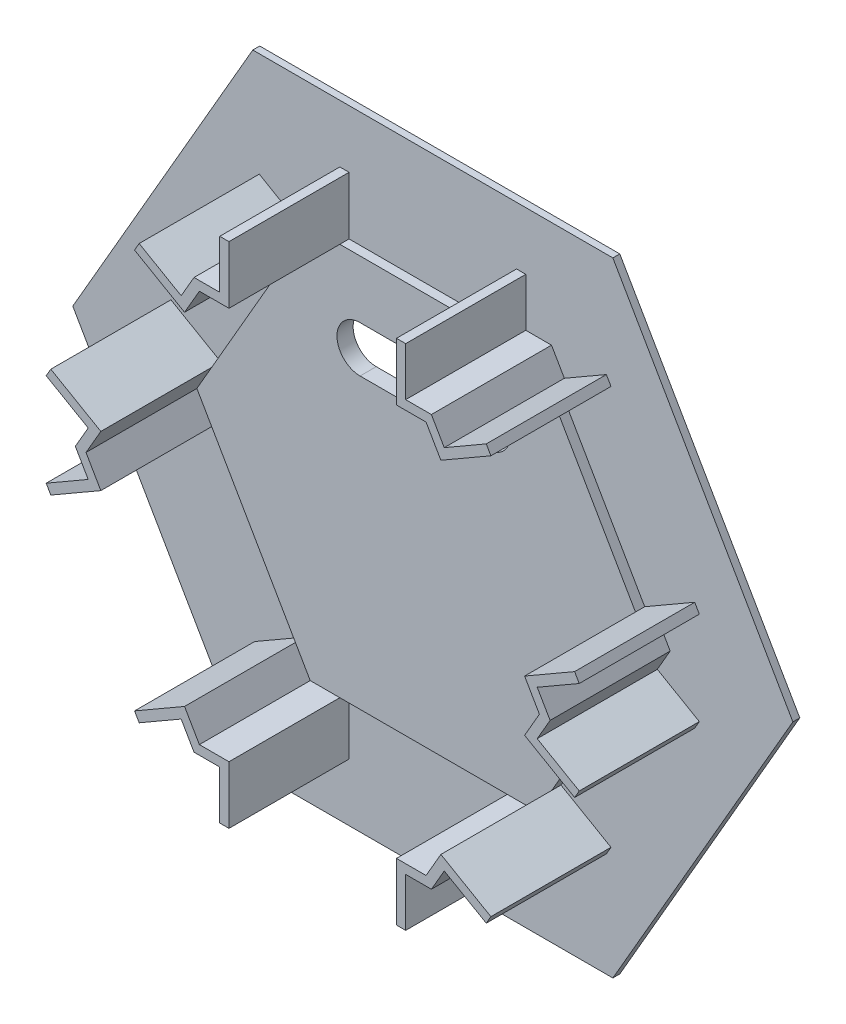
from build123d import *

# Parameters (mm, degrees)
BOSS_EXTRUDE1_DEPTH     = 1.4
SKETCH2_W               = 14.5
SKETCH2_H               = 10
BOSS_EXTRUDE2_DEPTH     = 0.6
BOSS_EXTRUDE3_DEPTH     = 11
BOSS_EXTRUDE4_DEPTH     = 0.6
CUT_EXTRUDE1_DEPTH      = 43.345719973
CUT_EXTRUDE1_DEPTH_BACK = 43.345719973


with BuildPart() as part:
    # Sketch1 → Boss-Extrude1 (new body)
    with BuildSketch(Plane.XY):
        Polygon((19.629909152, 0), (9.814954576, 17), (-9.814954576, 17), (-19.629909152, 0), (-9.814954576, -17), (9.814954576, -17), align=None)
    extrude(amount=BOSS_EXTRUDE1_DEPTH)

    # Sketch2 → Boss-Extrude2 (add)
    with BuildSketch(Plane.XY):
        with Locations((0, 22)):
            Rectangle(SKETCH2_W, SKETCH2_H)
        Polygon((19.757685902, 19.778684177), (27.007685902, 7.221315823), (18.347431864, 2.221315823), (11.097431864, 14.778684177), align=None)
        Polygon((27.007685902, -7.221315823), (19.757685902, -19.778684177), (11.097431864, -14.778684177), (18.347431864, -2.221315823), align=None)
        with Locations((0, -22)):
            Rectangle(SKETCH2_W, SKETCH2_H)
        Polygon((-19.757685902, -19.778684177), (-27.007685902, -7.221315823), (-18.347431864, -2.221315823), (-11.097431864, -14.778684177), align=None)
        Polygon((-27.007685902, 7.221315823), (-19.757685902, 19.778684177), (-11.097431864, 14.778684177), (-18.347431864, 2.221315823), align=None)
    extrude(amount=BOSS_EXTRUDE2_DEPTH)

    # Sketch3 → Boss-Extrude3 (add)
    with BuildSketch(Plane.XY):
        Polygon((-7.25, 22), (-8.05, 22), (-8.05, 17.8), (-10.276834792, 17.8), (-11.390252187, 15.8715045), (-15.027558883, 17.9715045), (-15.427558883, 17.278684177), (-11.097431864, 14.778684177), (-9.814954576, 17), (-7.25, 17), align=None)
        Polygon((15.427558883, 17.278684177), (15.027558883, 17.9715045), (11.390252187, 15.8715045), (10.276834792, 17.8), (8.05, 17.8), (8.05, 22), (7.25, 22), (7.25, 17), (9.814954576, 17), (11.097431864, 14.778684177), align=None)
        Polygon((22.677558883, -4.721315823), (23.077558883, -4.0284955), (19.440252187, -1.9284955), (20.553669583, 0), (19.440252187, 1.9284955), (23.077558883, 4.0284955), (22.677558883, 4.721315823), (18.347431864, 2.221315823), (19.629909152, 0), (18.347431864, -2.221315823), align=None)
        Polygon((7.25, -22), (8.05, -22), (8.05, -17.8), (10.276834792, -17.8), (11.390252187, -15.8715045), (15.027558883, -17.9715045), (15.427558883, -17.278684177), (11.097431864, -14.778684177), (9.814954576, -17), (7.25, -17), align=None)
        Polygon((-15.427558883, -17.278684177), (-15.027558883, -17.9715045), (-11.390252187, -15.8715045), (-10.276834792, -17.8), (-8.05, -17.8), (-8.05, -22), (-7.25, -22), (-7.25, -17), (-9.814954576, -17), (-11.097431864, -14.778684177), align=None)
        Polygon((-22.677558883, 4.721315823), (-23.077558883, 4.0284955), (-19.440252187, 1.9284955), (-20.553669583, 0), (-19.440252187, -1.9284955), (-23.077558883, -4.0284955), (-22.677558883, -4.721315823), (-18.347431864, -2.221315823), (-19.629909152, 0), (-18.347431864, 2.221315823), align=None)
    extrude(amount=BOSS_EXTRUDE3_DEPTH)

    # Sketch4 → Boss-Extrude4 (add)
    with BuildSketch(Plane.XY):
        Polygon((31.176914536, 0), (15.588457268, 27), (-15.588457268, 27), (-31.176914536, 0), (-15.588457268, -27), (15.588457268, -27), align=None)
    extrude(amount=BOSS_EXTRUDE4_DEPTH)

    # Sketch5 → Cut-Extrude1 (cut, two sides: drawn at the far end of the back side and taken through both)
    with BuildSketch(Plane.XY.offset(1.4).offset(-CUT_EXTRUDE1_DEPTH_BACK)):
        with BuildLine():
            Line((-5.5, 12), (5.5, 12))
            ThreePointArc((5.5, 12), (7.5, 10), (5.5, 8))
            Line((5.5, 8), (-5.5, 8))
            ThreePointArc((-5.5, 8), (-7.5, 10), (-5.5, 12))
        make_face()
    extrude(amount=CUT_EXTRUDE1_DEPTH + CUT_EXTRUDE1_DEPTH_BACK, mode=Mode.SUBTRACT)


solid = part.part
